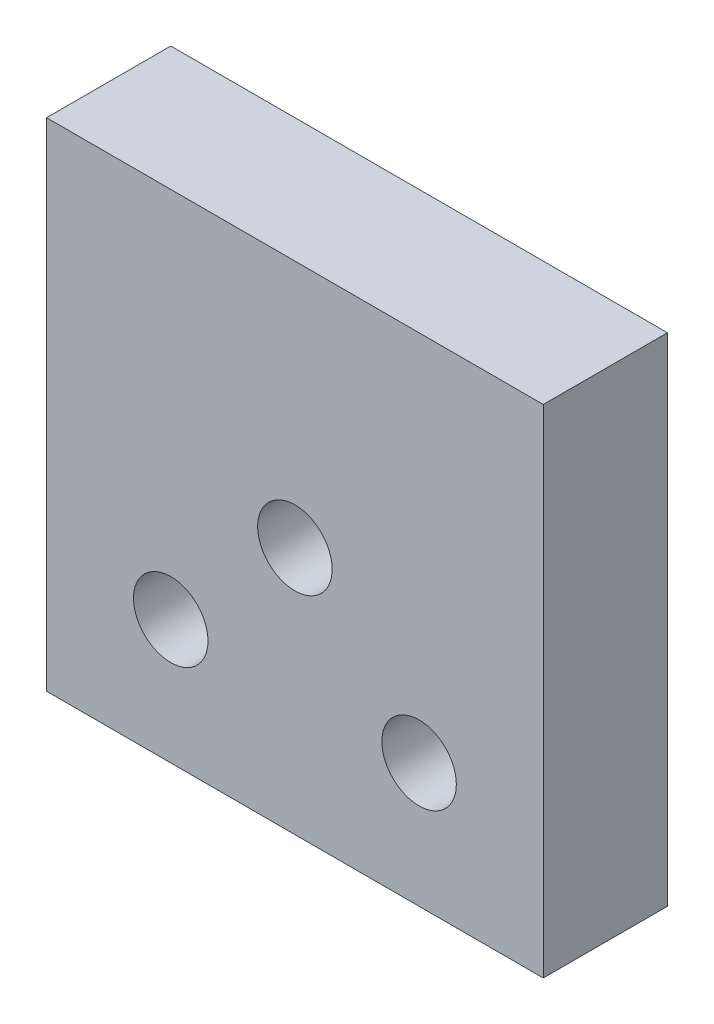
from build123d import *

# Parameters (mm, degrees)
SKETCH_1_W          = 20
SKETCH_1_H          = 20
SKETCH_1_R          = 1.5
EXTRUDE_1_DEPTH     = 5
SKETCH_2_R          = 1.5
CUT_EXTRUDE_1_DEPTH = 10


with BuildPart() as part:
    # 草图1 → 凸台-拉伸1 (new body)
    with BuildSketch(Plane.XY):
        Rectangle(SKETCH_1_W, SKETCH_1_H)
        Circle(SKETCH_1_R, mode=Mode.SUBTRACT)
    extrude(amount=EXTRUDE_1_DEPTH)

    # 草图2 → 切除-拉伸1 (cut)
    with BuildSketch(Plane.XY.offset(5)):
        with Locations((-5, -5)):
            Circle(SKETCH_2_R)
        with Locations((5, -5)):
            Circle(SKETCH_2_R)
    extrude(amount=-CUT_EXTRUDE_1_DEPTH, mode=Mode.SUBTRACT)


solid = part.part
